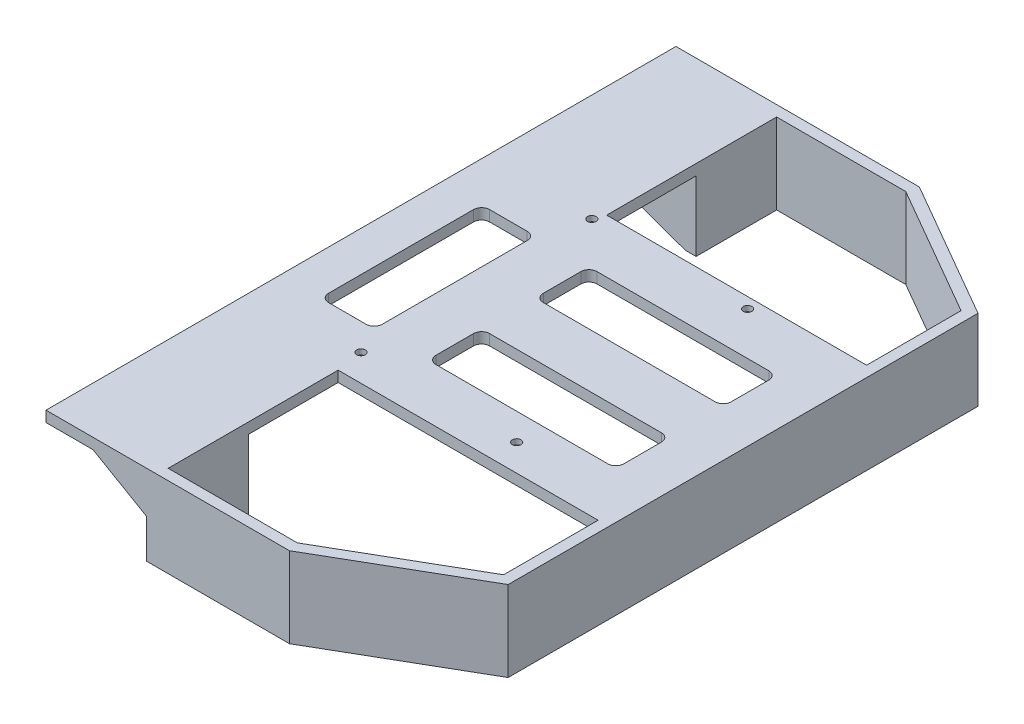
from build123d import *
from OCP.BRepFilletAPI import BRepFilletAPI_MakeChamfer

# Parameters (mm, degrees)
BOSS_EXTRUDE1_DEPTH = 30
CUT_EXTRUDE1_REACH  = 253.063
SKETCH10_W          = 41.5
SKETCH10_H          = 34
BOSS_EXTRUDE3_DEPTH = 4
CHAMFER4_SIZE       = 20
CHAMFER4_SIZE2      = 11.547005384
SKETCH11_W          = 20.75
SKETCH11_H          = 166.64
BOSS_EXTRUDE4_DEPTH = 4
SKETCH12_W          = 20.75
SKETCH12_H          = 33.32
BOSS_EXTRUDE5_DEPTH = 4
SKETCH13_W          = 20
SKETCH13_H          = 60
SKETCH13_W_2        = 70
SKETCH13_H_2        = 20
CUT_EXTRUDE2_DEPTH  = 4
FILLET2_R           = 3
SKETCH14_R          = 1.6
CUT_EXTRUDE3_DEPTH  = 4
CUT_EXTRUDE4_START  = -2
SKETCH15_R          = 3.5
SKETCH15_R_2        = 1.6
CUT_EXTRUDE4_DEPTH  = 2


with BuildPart() as part:
    # Sketch6 → Boss-Extrude1 (new body)
    with BuildSketch(Plane(origin=(0, 0, 0), x_dir=(1, 0, 0), z_dir=(0, 1, 0))):
        Polygon((0, -87.32), (37.5, -87.32), (37.5, -117.32), (90.67, -117.32), (142.319755082, -87.5), (142.319755082, 87.5), (90.67, 117.32), (37.5, 117.32), (37.5, 87.32), (0, 87.32), (0, 83.32), (41.5, 83.32), (41.5, 113.32), (89.59820323, 113.32), (138.319755082, 85.190598923), (138.319755082, -85.190598923), (89.59820323, -113.32), (41.5, -113.32), (41.5, -83.32), (0, -83.32), align=None)
    extrude(amount=BOSS_EXTRUDE1_DEPTH)

    # Sketch9 → Cut-Extrude1 (cut, up to next)
    with BuildSketch(Plane.XY.offset(87.32), mode=Mode.PRIVATE) as cut_extrude1_sk1:
        Polygon((37.5, 0), (15, 8), (0, 8), (0, 0), align=None)
    cut_extrude1_tool1 = extrude(cut_extrude1_sk1.sketch, amount=-CUT_EXTRUDE1_REACH, mode=Mode.PRIVATE) & part.part
    cut_extrude1 = cut_extrude1_tool1.solids().sort_by_distance((13.928571, 3.428571, 87.32))[0]
    add(cut_extrude1, mode=Mode.SUBTRACT)

    # Sketch10 → Boss-Extrude3 (add)
    with BuildSketch(Plane(origin=(0, 30, 0), x_dir=(1, 0, 0), z_dir=(0, 1, 0))):
        with Locations((20.75, -100.32)):
            Rectangle(SKETCH10_W, SKETCH10_H)
    boss_extrude3 = extrude(amount=-BOSS_EXTRUDE3_DEPTH)

    # Mirror1: Cut-Extrude1, Boss-Extrude3 across plane
    add(cut_extrude1.mirror(Plane.XY), mode=Mode.SUBTRACT)
    add(boss_extrude3.mirror(Plane.XY))

    # Chamfer4: one chamfer whose edges measure the first distance from different faces: ONE call of the kernel's chamfer builder (chamfer() names one face for all edges)
    chamfer4_edges_1 = [part.edges().sort_by_distance(p)[0] for p in [
        (37.5, 26, -102.32),
    ]]
    chamfer4_side_1 = [part.faces().sort_by_distance(p)[0] for p in [
        (18.75, 26, -102.32),
    ]]
    chamfer4_edges_2 = [part.edges().sort_by_distance(p)[0] for p in [
        (37.5, 26, 102.32),
    ]]
    chamfer4_side_2 = [part.faces().sort_by_distance(p)[0] for p in [
        (18.75, 26, 102.32),
    ]]
    chamfer4 = BRepFilletAPI_MakeChamfer(part.part.solid().wrapped)
    for e in chamfer4_edges_1:
        chamfer4.Add(CHAMFER4_SIZE, CHAMFER4_SIZE2, e.wrapped, chamfer4_side_1[0].wrapped)  # the first distance lies on this face
    for e in chamfer4_edges_2:
        chamfer4.Add(CHAMFER4_SIZE, CHAMFER4_SIZE2, e.wrapped, chamfer4_side_2[0].wrapped)  # the first distance lies on this face
    add(Compound.cast(chamfer4.Shape()), mode=Mode.REPLACE)

    # Sketch11 → Boss-Extrude4 (add)
    with BuildSketch(Plane(origin=(0, 30, 0), x_dir=(1, 0, 0), z_dir=(0, 1, 0))):
        with Locations((10.375, 0)):
            Rectangle(SKETCH11_W, SKETCH11_H)
    extrude(amount=-BOSS_EXTRUDE4_DEPTH)

    # Sketch12 → Boss-Extrude5 (add)
    with BuildSketch(Plane(origin=(0, 30, 0), x_dir=(1, 0, 0), z_dir=(0, 1, 0))):
        Polygon((41.5, 50), (20.75, 50), (20.75, -50), (41.5, -50), (138.319755082, -50), (138.319755082, 50), align=None)
        with Locations((31.125, -66.66)):
            Rectangle(SKETCH12_W, SKETCH12_H)
        with Locations((31.125, 66.66)):
            Rectangle(SKETCH12_W, SKETCH12_H)
    extrude(amount=-BOSS_EXTRUDE5_DEPTH)

    # Sketch13 → Cut-Extrude2 (cut)
    with BuildSketch(Plane(origin=(0, 30, 0), x_dir=(1, 0, 0), z_dir=(0, 1, 0))):
        with Locations((24.909877541, 0)):
            Rectangle(SKETCH13_W, SKETCH13_H)
        with Locations((89.909877541, 20)):
            Rectangle(SKETCH13_W_2, SKETCH13_H_2)
        with Locations((89.909877541, -20)):
            Rectangle(SKETCH13_W_2, SKETCH13_H_2)
    extrude(amount=-CUT_EXTRUDE2_DEPTH, mode=Mode.SUBTRACT)

    # Fillet2
    fillet2_edges = [part.edges().sort_by_distance(p)[0] for p in [
        (54.909877541, 28, 30),
        (54.909877541, 28, 10),
        (124.909877541, 28, 10),
        (124.909877541, 28, 30),
        (34.909877541, 28, -30),
        (34.909877541, 28, 30),
        (14.909877541, 28, 30),
        (14.909877541, 28, -30),
        (54.909877541, 28, -10),
        (54.909877541, 28, -30),
        (124.909877541, 28, -30),
        (124.909877541, 28, -10),
    ]]
    fillet(fillet2_edges, radius=FILLET2_R)

    # Sketch14 → Cut-Extrude3 (cut)
    with BuildSketch(Plane(origin=(0, 30, 0), x_dir=(1, 0, 0), z_dir=(0, 1, 0))):
        with Locations(Location((39.997609887, -40.001015731, 0), (0, 0, 270))):
            Circle(SKETCH14_R)
        with Locations(Location((97.997609783, -40.004481411, 0), (0, 0, 270))):
            Circle(SKETCH14_R)
        with Locations(Location((40.002748653, 45.998984115, 0), (0, 0, 270))):
            Circle(SKETCH14_R)
        with Locations(Location((98.00274855, 45.995518435, 0), (0, 0, 270))):
            Circle(SKETCH14_R)
    extrude(amount=-CUT_EXTRUDE3_DEPTH, mode=Mode.SUBTRACT)

    # Sketch15 → Cut-Extrude4 (cut)
    # profile 1 of 8: a face of its own
    with BuildSketch(Plane.XZ.offset(-26).offset(CUT_EXTRUDE4_START)):
        with Locations(Location((40.002748653, -45.998984115, 0), (0, 0, 270))):
            Circle(SKETCH15_R)
        with Locations(Location((40.002748653, -45.998984115, 0), (0, 0, 90))):
            Circle(SKETCH15_R_2, mode=Mode.SUBTRACT)
    # profile 2 of 8: a face of its own
    with BuildSketch(Plane.XZ.offset(-26).offset(CUT_EXTRUDE4_START)):
        with BuildLine():
            Line((101.50274855, -50), (101.50274855, -45.995518435))
            ThreePointArc((101.50274855, -45.995518435), (98.00274855, -49.495518435), (94.50274855, -45.995518435))
            Line((94.50274855, -45.995518435), (94.50274855, -50))
            Line((94.50274855, -50), (101.50274855, -50))
        make_face()
    # profile 3 of 8: a face of its own
    with BuildSketch(Plane.XZ.offset(-26).offset(CUT_EXTRUDE4_START)):
        with BuildLine():
            ThreePointArc((94.50274855, -45.995518435), (98.00274855, -49.495518435), (101.50274855, -45.995518435))
            Line((101.50274855, -45.995518435), (99.60274855, -45.995518435))
            ThreePointArc((99.60274855, -45.995518435), (98.00274855, -47.595518435), (96.40274855, -45.995518435))
            Line((96.40274855, -45.995518435), (94.50274855, -45.995518435))
        make_face()
    # profile 4 of 8: a face of its own
    with BuildSketch(Plane.XZ.offset(-26).offset(CUT_EXTRUDE4_START)):
        with BuildLine():
            Line((99.60274855, -45.995518435), (101.50274855, -45.995518435))
            ThreePointArc((101.50274855, -45.995518435), (98.00274855, -42.495518435), (94.50274855, -45.995518435))
            Line((94.50274855, -45.995518435), (96.40274855, -45.995518435))
            ThreePointArc((96.40274855, -45.995518435), (98.00274855, -44.395518435), (99.60274855, -45.995518435))
        make_face()
    # profile 5 of 8: a face of its own
    with BuildSketch(Plane.XZ.offset(-26).offset(CUT_EXTRUDE4_START)):
        with BuildLine():
            ThreePointArc((94.50274855, -45.995518435), (98.00274855, -49.495518435), (101.50274855, -45.995518435))
            Line((101.50274855, -45.995518435), (99.60274855, -45.995518435))
            ThreePointArc((99.60274855, -45.995518435), (98.00274855, -47.595518435), (96.40274855, -45.995518435))
            Line((96.40274855, -45.995518435), (94.50274855, -45.995518435))
        make_face()
    # profile 6 of 8: a face of its own
    with BuildSketch(Plane.XZ.offset(-26).offset(CUT_EXTRUDE4_START)):
        with BuildLine():
            Line((99.60274855, -45.995518435), (101.50274855, -45.995518435))
            ThreePointArc((101.50274855, -45.995518435), (98.00274855, -42.495518435), (94.50274855, -45.995518435))
            Line((94.50274855, -45.995518435), (96.40274855, -45.995518435))
            ThreePointArc((96.40274855, -45.995518435), (98.00274855, -44.395518435), (99.60274855, -45.995518435))
        make_face()
    # profile 7 of 8: a face of its own
    with BuildSketch(Plane.XZ.offset(-26).offset(CUT_EXTRUDE4_START)):
        with Locations(Location((97.997609783, 40.004481411, 0), (0, 0, 270))):
            Circle(SKETCH15_R)
        with Locations(Location((97.997609783, 40.004481411, 0), (0, 0, 90))):
            Circle(SKETCH15_R_2, mode=Mode.SUBTRACT)
    # profile 8 of 8: a face of its own
    with BuildSketch(Plane.XZ.offset(-26).offset(CUT_EXTRUDE4_START)):
        with Locations(Location((39.997609887, 40.001015731, 0), (0, 0, 270))):
            Circle(SKETCH15_R)
        with Locations(Location((39.997609887, 40.001015731, 0), (0, 0, 90))):
            Circle(SKETCH15_R_2, mode=Mode.SUBTRACT)
    extrude(amount=CUT_EXTRUDE4_DEPTH, mode=Mode.SUBTRACT)


solid = part.part
